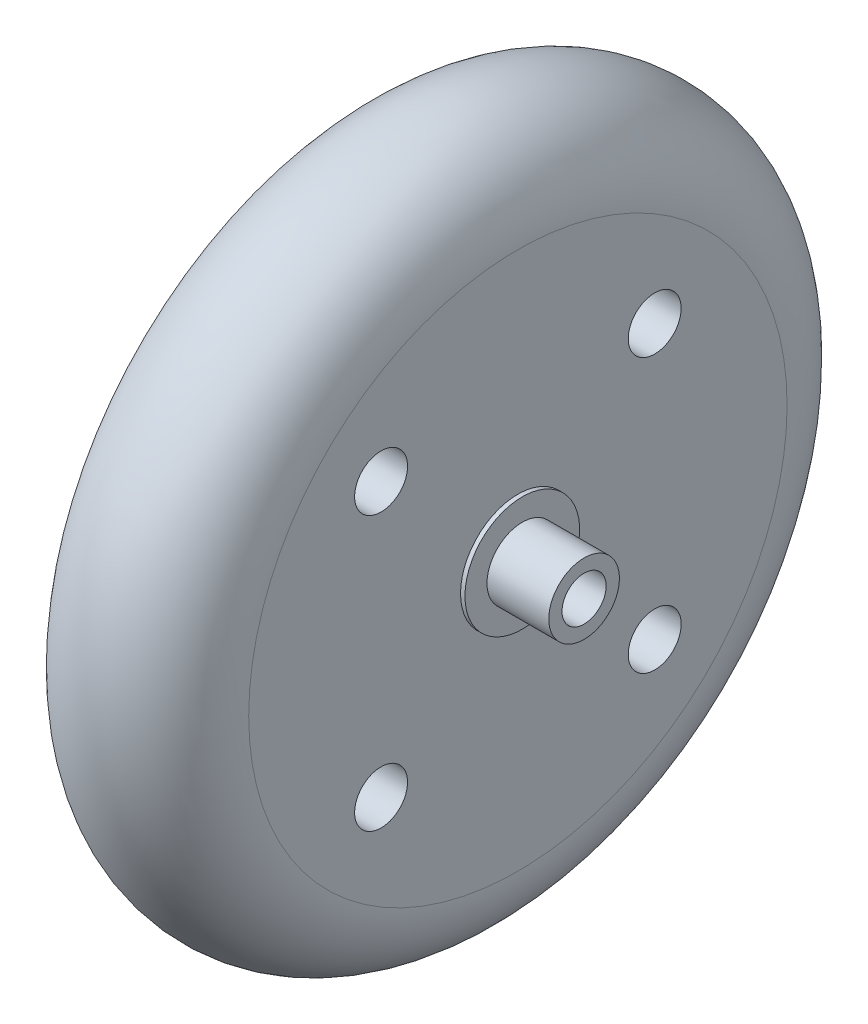
from build123d import *

# Parameters (mm, degrees)
SKETCH2_R          = 3
CUT_EXTRUDE1_DEPTH = 60.674115125


with BuildPart() as part:
    # Sketch1 → Revolve1 (revolve)
    with BuildSketch(Plane.XY, mode=Mode.PRIVATE) as revolve1_sk:
        with BuildLine():
            Line((27, 4), (27, 2.5))
            Line((27, 2.5), (20, 2.5))
            Line((20, 2.5), (0.5, 2.5))
            Line((0.5, 2.5), (0.5, 30.5))
            ThreePointArc((0.5, 30.5), (10, 40), (19.5, 30.5))
            Line((19.5, 30.5), (19.5, 6.5))
            Line((19.5, 6.5), (20, 6.5))
            Line((20, 6.5), (20, 4))
            Line((20, 4), (27, 4))
        make_face()
    revolve(revolve1_sk.sketch.rotate(Axis((0, 0, 0), (1, 0, 0)), 90), axis=Axis((0, 0, 0), (1, 0, 0)))

    # Sketch2 → Cut-Extrude1 (cut, through all)
    with BuildSketch(Plane(origin=(19.5, 0, 0), x_dir=(0, 0, -1), z_dir=(1, 0, 0))):
        with Locations((-15.5, 15.5)):
            Circle(SKETCH2_R)
        with Locations((15.5, 15.5)):
            Circle(SKETCH2_R)
        with Locations((15.5, -15.5)):
            Circle(SKETCH2_R)
        with Locations((-15.5, -15.5)):
            Circle(SKETCH2_R)
    extrude(amount=-CUT_EXTRUDE1_DEPTH, mode=Mode.SUBTRACT)


solid = part.part
